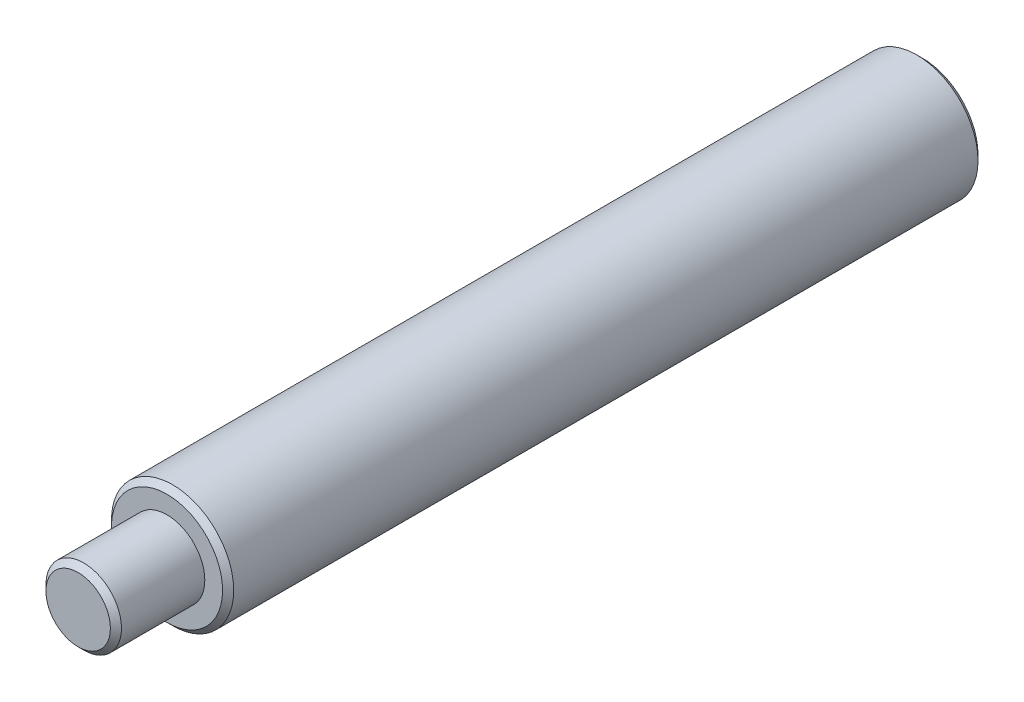
from build123d import *

# Parameters (mm, degrees)
SKETCH_1_R             = 5.5
EXTRUDE_1_DEPTH        = 68
CHAMFER_1_SIZE         = 0.5
SKETCH_2_R             = 3.4
EXTRUDE_2_DEPTH        = 8
CHAMFER_2_SIZE         = 0.5
HOLE_WIZARD_M5_1_D     = 4.2
HOLE_WIZARD_M5_1_DEPTH = 12.4
HOLE_WIZARD_M5_1_TIP   = 1.2618073
CHAMFER_3_SIZE         = 0.5


with BuildPart() as part:
    # 草图1 → 拉伸1 (new body)
    with BuildSketch(Plane.XY):
        Circle(SKETCH_1_R)
    extrude(amount=EXTRUDE_1_DEPTH)

    # 倒角1
    chamfer_1_edges = [part.edges().sort_by_distance(p)[0] for p in [
        (-5.5, 0, 0),
        (-5.5, 0, 68),
    ]]
    chamfer(chamfer_1_edges, length=CHAMFER_1_SIZE)

    # 草图2 → 拉伸2 (add)
    with BuildSketch(Plane.XY.offset(68)):
        Circle(SKETCH_2_R)
    extrude(amount=EXTRUDE_2_DEPTH)

    # 倒角2
    chamfer_2_edges = [part.edges().sort_by_distance(p)[0] for p in [
        (-3.4, 0, 76),
    ]]
    chamfer(chamfer_2_edges, length=CHAMFER_2_SIZE)

    # M5 螺纹孔1
    with Locations(Plane(origin=(0, 0, 0), x_dir=(-1, 0, 0), z_dir=(0, 0, -1))):
        with Locations((0, 0)):
            Hole(HOLE_WIZARD_M5_1_D / 2, depth=HOLE_WIZARD_M5_1_DEPTH)
            with Locations((0, 0, -(HOLE_WIZARD_M5_1_DEPTH + HOLE_WIZARD_M5_1_TIP / 2))):  # 118° drill point
                Cone(0, HOLE_WIZARD_M5_1_D / 2, HOLE_WIZARD_M5_1_TIP, mode=Mode.SUBTRACT)

    # 倒角3
    chamfer_3_edges = [part.edges().sort_by_distance(p)[0] for p in [
        (-2.1, 0, 0),
    ]]
    chamfer(chamfer_3_edges, length=CHAMFER_3_SIZE)


solid = part.part
